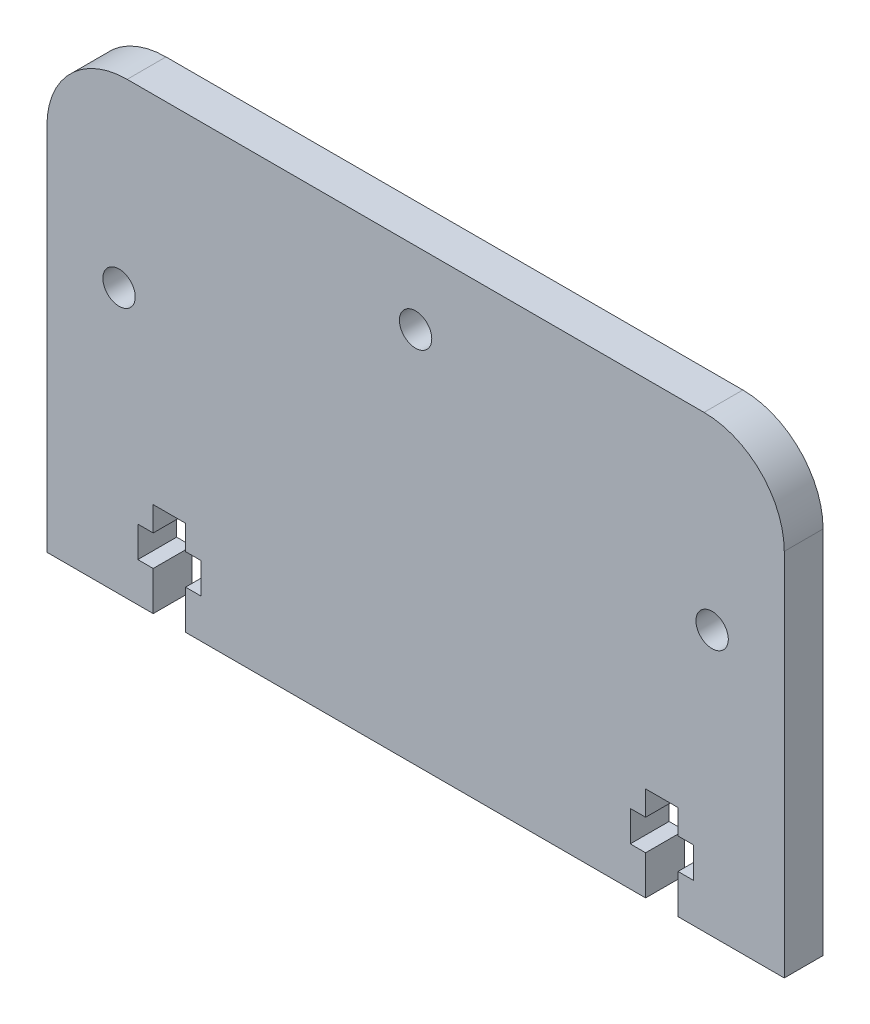
from build123d import *

# Parameters (mm, degrees)
BOSS_EXTRUDE1_DEPTH = 6
CUT_EXTRUDE1_DEPTH  = 91.068866014
SKETCH4_R           = 2.5
HOLE1_DEPTH         = 91.068866014
SKETCH5_R           = 2.5
HOLE2_DEPTH         = 91.068866014


with BuildPart() as part:
    # Sketch2 → Boss-Extrude1 (new body)
    with BuildSketch(Plane.XY):
        with BuildLine():
            Line((-56.975, 0), (56.975, 0))
            Line((56.975, 0), (56.975, 57.1))
            ThreePointArc((56.975, 57.1), (53.343124087, 65.868124087), (44.575, 69.5))
            Line((44.575, 69.5), (-44.575, 69.5))
            ThreePointArc((-44.575, 69.5), (-53.343124087, 65.868124087), (-56.975, 57.1))
            Line((-56.975, 57.1), (-56.975, 0))
        make_face()
    extrude(amount=BOSS_EXTRUDE1_DEPTH)

    # Sketch3 → Cut-Extrude1 (cut, through all)
    with BuildSketch(Plane.XY.offset(6)):
        Polygon((-40.55, 0), (-35.55, 0), (-35.55, 6.05), (-33.175, 6.05), (-33.175, 10.8), (-35.55, 10.8), (-35.55, 14.6), (-40.55, 14.6), (-40.55, 10.8), (-42.925, 10.8), (-42.925, 6.05), (-40.55, 6.05), align=None)
    cut_extrude1 = extrude(amount=-CUT_EXTRUDE1_DEPTH, mode=Mode.SUBTRACT)

    # Sketch4 → Hole1 (cut, through all)
    with BuildSketch(Plane.XY.offset(6)):
        with Locations((-45.825, 41)):
            Circle(SKETCH4_R)
    hole1 = extrude(amount=-HOLE1_DEPTH, mode=Mode.SUBTRACT)

    # Sketch5 → Hole2 (cut, through all)
    with BuildSketch(Plane.XY.offset(6)):
        with Locations((0, 58.3)):
            Circle(SKETCH5_R)
    extrude(amount=-HOLE2_DEPTH, mode=Mode.SUBTRACT)

    # Mirror1: Cut-Extrude1, Hole1 across plane
    add(cut_extrude1.mirror(Plane(origin=(0, 0, 0), x_dir=(0, 0, 1), z_dir=(1, 0, 0))), mode=Mode.SUBTRACT)
    add(hole1.mirror(Plane(origin=(0, 0, 0), x_dir=(0, 0, 1), z_dir=(1, 0, 0))), mode=Mode.SUBTRACT)


solid = part.part
